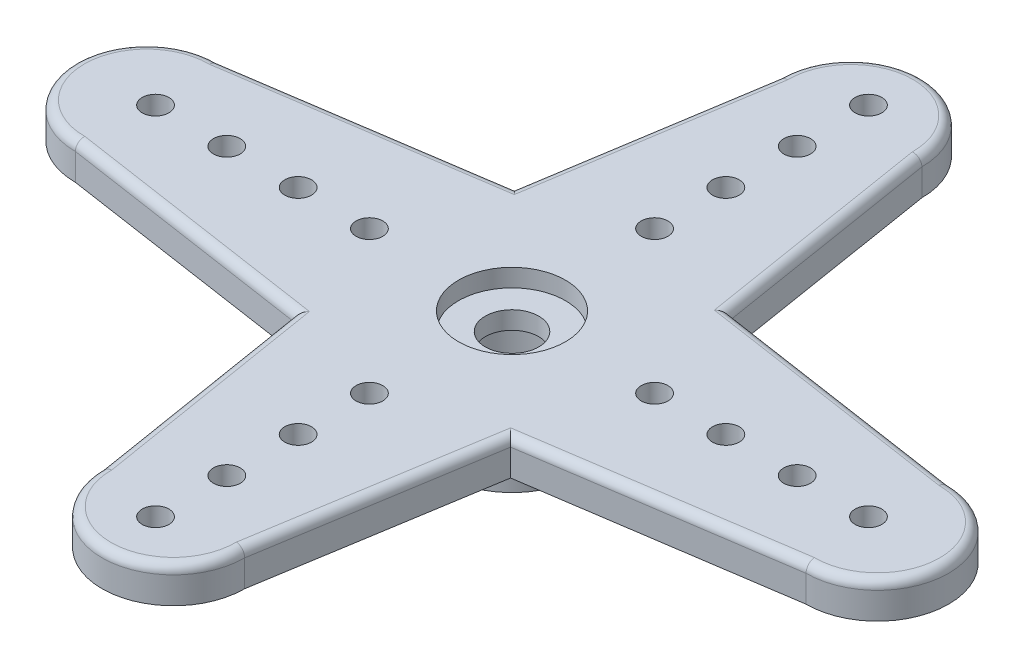
from build123d import *

# Parameters (mm, degrees)
BOSS_EXTRUDE1_DEPTH = 2
SKETCH9_R           = 3
CUT_EXTRUDE1_DEPTH  = 1
SKETCH10_R          = 1.5
CUT_EXTRUDE2_DEPTH  = 1
SKETCH11_R          = 4
SKETCH11_R_2        = 3
BOSS_EXTRUDE2_DEPTH = 4
SKETCH12_R          = 0.75
CUT_EXTRUDE3_DEPTH  = 4
FILLET2_R           = 0.5
FILLET3_R           = 0.25


with BuildPart() as part:
    # Sketch2 → Boss-Extrude1 (new body)
    with BuildSketch(Plane(origin=(0, 0, 0), x_dir=(1, 0, 0), z_dir=(0, 1, 0))):
        with BuildLine():
            Line((-4, 19), (-6.02759697, 6.158552525))
            Line((-6.02759697, 6.158552525), (-20.5, 4))
            ThreePointArc((-20.5, 4), (-24.5, 0), (-20.5, -4))
            Line((-20.5, -4), (-6.091386588, -6.149038332))
            Line((-6.091386588, -6.149038332), (-4, -19))
            ThreePointArc((-4, -19), (0, -23), (4, -19))
            Line((4, -19), (6.078807779, -6.156670477))
            Line((6.078807779, -6.156670477), (20.5, -4))
            ThreePointArc((20.5, -4), (24.5, 0), (20.5, 4))
            Line((20.5, 4), (6.070582171, 6.157900606))
            Line((6.070582171, 6.157900606), (4, 19))
            ThreePointArc((4, 19), (0, 23), (-4, 19))
        make_face()
    extrude(amount=BOSS_EXTRUDE1_DEPTH)

    # Sketch9 → Cut-Extrude1 (cut)
    with BuildSketch(Plane(origin=(0, 2, 0), x_dir=(1, 0, 0), z_dir=(0, 1, 0))):
        with Locations(Location((0, 0, 0), (0, 0, 270))):
            Circle(SKETCH9_R)
    extrude(amount=-CUT_EXTRUDE1_DEPTH, mode=Mode.SUBTRACT)

    # Sketch10 → Cut-Extrude2 (cut)
    with BuildSketch(Plane(origin=(0, 1, 0), x_dir=(1, 0, 0), z_dir=(0, 1, 0))):
        with Locations(Location((0, 0, 0), (0, 0, 270))):
            Circle(SKETCH10_R)
    extrude(amount=-CUT_EXTRUDE2_DEPTH, mode=Mode.SUBTRACT)

    # Sketch11 → Boss-Extrude2 (add)
    with BuildSketch(Plane.XZ):
        with Locations(Location((0, 0, 0), (0, 0, 90))):
            Circle(SKETCH11_R)
        with Locations(Location((0, 0, 0), (0, 0, 90))):
            Circle(SKETCH11_R_2, mode=Mode.SUBTRACT)
    extrude(amount=BOSS_EXTRUDE2_DEPTH)

    # Sketch12 → Cut-Extrude3 (cut)
    with BuildSketch(Plane(origin=(0, 2, 0), x_dir=(1, 0, 0), z_dir=(0, 1, 0))):
        with Locations(Location((0, 8, 0), (0, 0, 270))):
            Circle(SKETCH12_R)
        with Locations(Location((0, 12, 0), (0, 0, 270))):
            Circle(SKETCH12_R)
        with Locations(Location((0, 16, 0), (0, 0, 270))):
            Circle(SKETCH12_R)
        with Locations(Location((0, 20, 0), (0, 0, 270))):
            Circle(SKETCH12_R)
        with Locations(Location((20, 0, 0), (0, 0, 270))):
            Circle(SKETCH12_R)
        with Locations(Location((16, 0, 0), (0, 0, 270))):
            Circle(SKETCH12_R)
        with Locations(Location((12, 0, 0), (0, 0, 270))):
            Circle(SKETCH12_R)
        with Locations(Location((8, 0, 0), (0, 0, 270))):
            Circle(SKETCH12_R)
        with Locations(Location((0, -20, 0), (0, 0, 270))):
            Circle(SKETCH12_R)
        with Locations(Location((0, -16, 0), (0, 0, 270))):
            Circle(SKETCH12_R)
        with Locations(Location((0, -12, 0), (0, 0, 270))):
            Circle(SKETCH12_R)
        with Locations(Location((0, -8, 0), (0, 0, 270))):
            Circle(SKETCH12_R)
        with Locations(Location((-20, 0, 0), (0, 0, 270))):
            Circle(SKETCH12_R)
        with Locations(Location((-16, 0, 0), (0, 0, 270))):
            Circle(SKETCH12_R)
        with Locations(Location((-12, 0, 0), (0, 0, 270))):
            Circle(SKETCH12_R)
        with Locations(Location((-8, 0, 0), (0, 0, 270))):
            Circle(SKETCH12_R)
    extrude(amount=-CUT_EXTRUDE3_DEPTH, mode=Mode.SUBTRACT)

    # Fillet2
    fillet2_edges = [part.edges().sort_by_distance(p)[0] for p in [
        (0, 2, -23),
        (-5.013798485, 2, -12.579276263),
        (-13.263798485, 2, -5.079276263),
        (-24.5, 2, 0),
        (-13.295693294, 2, 5.074519166),
        (-5.045693294, 2, 12.574519166),
        (0, 2, 23),
        (5.03940389, 2, 12.578335238),
        (13.28940389, 2, 5.078335238),
        (24.5, 2, 0),
        (13.285291086, 2, -5.078950303),
        (5.035291086, 2, -12.578950303),
    ]]
    fillet(fillet2_edges, radius=FILLET2_R)

    # Fillet3
    fillet3_edges = [part.edges().sort_by_distance(p)[0] for p in [
        (0, 0, -4),
    ]]
    fillet(fillet3_edges, radius=FILLET3_R)


solid = part.part
